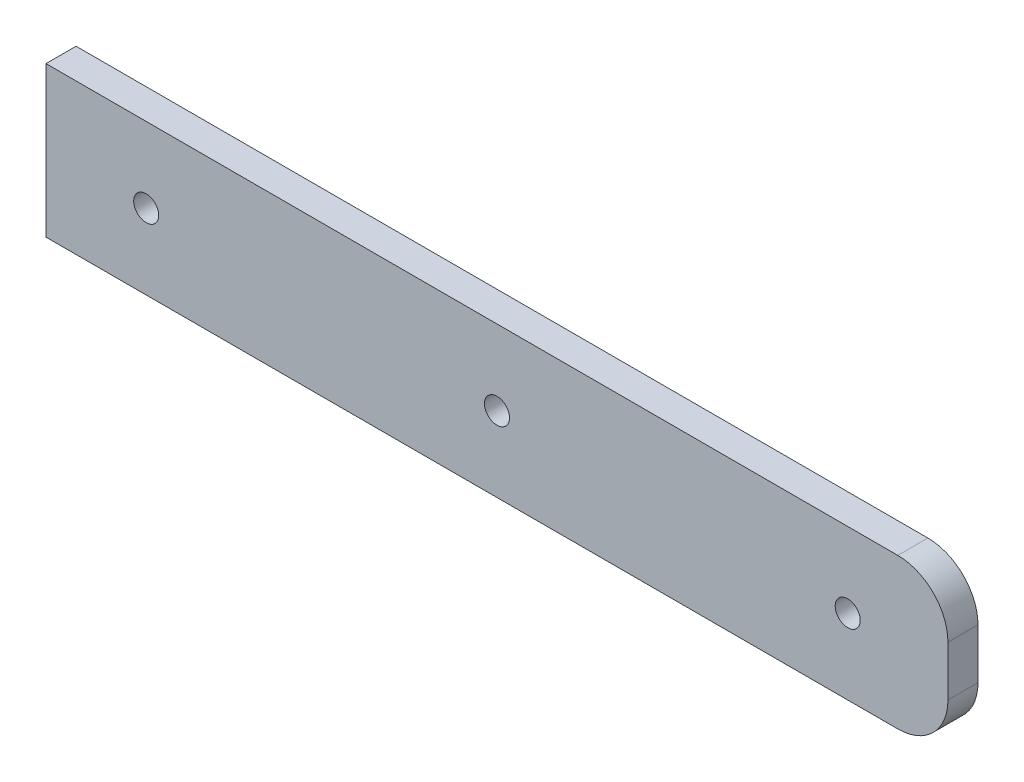
from build123d import *

# Parameters (mm, degrees)
SKETCH2_W           = 180
SKETCH2_H           = 30
SKETCH2_R           = 2.5
BOSS_EXTRUDE1_DEPTH = 6
FILLET1_R           = 10


with BuildPart() as part:
    # Sketch2 → Boss-Extrude1 (new body)
    with BuildSketch(Plane.XY):
        with Locations((112.677406729, 303.328575943)):
            Rectangle(SKETCH2_W, SKETCH2_H)
        with Locations((42.677406729, 303.328575943)):
            Circle(SKETCH2_R, mode=Mode.SUBTRACT)
        with Locations((112.677406729, 303.328575943)):
            Circle(SKETCH2_R, mode=Mode.SUBTRACT)
        with Locations((182.677406729, 303.328575943)):
            Circle(SKETCH2_R, mode=Mode.SUBTRACT)
    extrude(amount=BOSS_EXTRUDE1_DEPTH)

    # Fillet1
    fillet1_edges = [part.edges().sort_by_distance(p)[0] for p in [
        (202.677406729, 288.328575943, 3),
        (202.677406729, 318.328575943, 3),
    ]]
    fillet(fillet1_edges, radius=FILLET1_R)


solid = part.part
